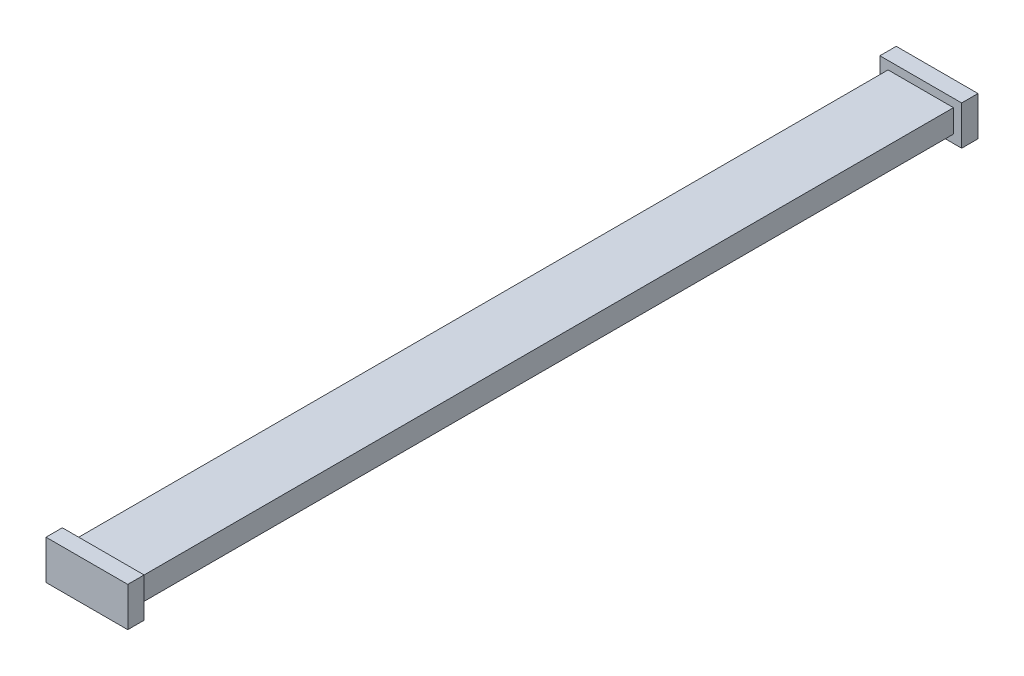
from build123d import *

# Parameters (mm, degrees)
SKETCH_1_W      = 20
SKETCH_1_H      = 7
EXTRUDE_1_DEPTH = 250
SKETCH_2_W      = 25
SKETCH_2_H      = 12
EXTRUDE_2_DEPTH = 5
SKETCH_3_W      = 25
SKETCH_3_H      = 12
EXTRUDE_3_DEPTH = 5


with BuildPart() as part:
    # 草图1 → 凸台-拉伸1 (new body)
    with BuildSketch(Plane.XY):
        Rectangle(SKETCH_1_W, SKETCH_1_H)
    extrude(amount=EXTRUDE_1_DEPTH)

    # 草图2 → 凸台-拉伸2 (add)
    with BuildSketch(Plane.XY.offset(250)):
        Rectangle(SKETCH_2_W, SKETCH_2_H)
    extrude(amount=EXTRUDE_2_DEPTH)

    # 草图3 → 凸台-拉伸3 (add)
    with BuildSketch(Plane(origin=(0, 0, 0), x_dir=(-1, 0, 0), z_dir=(0, 0, -1))):
        Rectangle(SKETCH_3_W, SKETCH_3_H)
    extrude(amount=EXTRUDE_3_DEPTH)


solid = part.part
